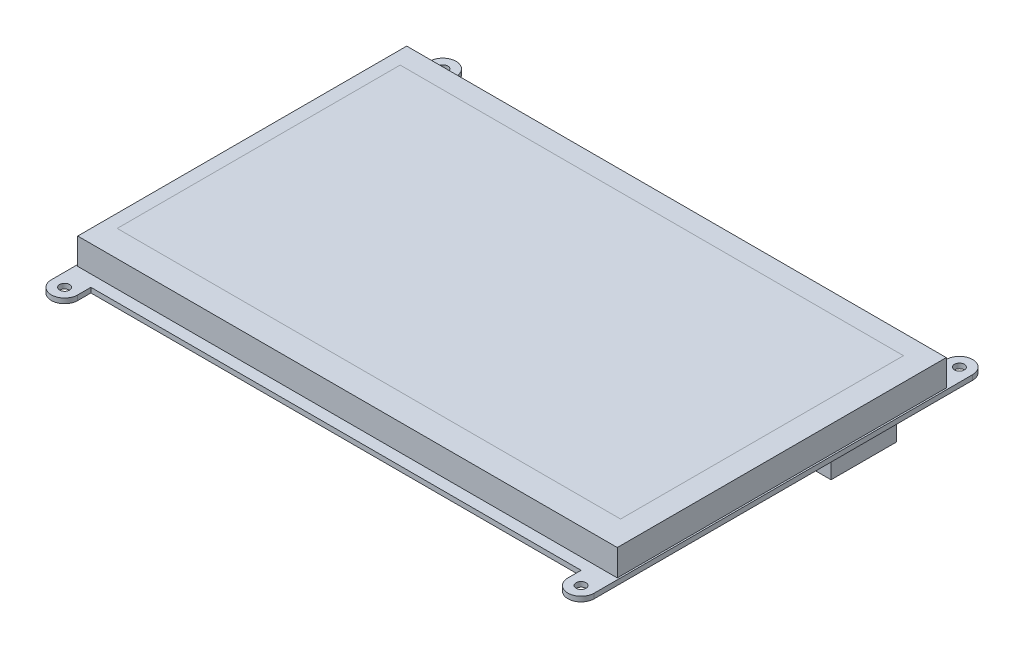
from build123d import *

# Parameters (mm, degrees)
SKETCH1_R           = 1.5
BOSS_EXTRUDE1_DEPTH = 1.5
SKETCH2_W           = 8.49594542
SKETCH2_H           = 19.836738538
SKETCH2_W_2         = 18.514132699
SKETCH2_H_2         = 9.878260544
BOSS_EXTRUDE2_DEPTH = 8
SKETCH3_W           = 164
SKETCH3_H           = 100
BOSS_EXTRUDE3_DEPTH = 8


with BuildPart() as part:
    # Sketch1 → Boss-Extrude1 (new body)
    with BuildSketch(Plane(origin=(0, 0, 0), x_dir=(1, 0, 0), z_dir=(0, 1, 0))):
        with BuildLine():
            Line((-74.5, -53.5), (74.5, -53.5))
            Line((74.5, -53.5), (74.5, -57.5))
            ThreePointArc((74.5, -57.5), (78.5, -61.5), (82.5, -57.5))
            Line((82.5, -57.5), (82.5, -23.877612559))
            Line((82.5, -23.877612559), (82.5, 23.877612559))
            Line((82.5, 23.877612559), (82.5, 57.5))
            ThreePointArc((82.5, 57.5), (78.5, 61.5), (74.5, 57.5))
            Line((74.5, 57.5), (74.5, 53.5))
            Line((74.5, 53.5), (-74.5, 53.5))
            Line((-74.5, 53.5), (-74.5, 57.5))
            ThreePointArc((-74.5, 57.5), (-78.5, 61.5), (-82.5, 57.5))
            Line((-82.5, 57.5), (-82.5, 23.877612559))
            Line((-82.5, 23.877612559), (-82.5, -23.877612559))
            Line((-82.5, -23.877612559), (-82.5, -57.5))
            ThreePointArc((-82.5, -57.5), (-78.5, -61.5), (-74.5, -57.5))
            Line((-74.5, -57.5), (-74.5, -53.5))
        make_face()
        with Locations(Location((78.5, 57.5, 0), (0, 0, 270))):
            Circle(SKETCH1_R, mode=Mode.SUBTRACT)
        with Locations(Location((-78.5, 57.5, 0), (0, 0, 90))):
            Circle(SKETCH1_R, mode=Mode.SUBTRACT)
        with Locations(Location((78.5, -57.5, 0), (0, 0, 90))):
            Circle(SKETCH1_R, mode=Mode.SUBTRACT)
        with Locations(Location((-78.5, -57.5, 0), (0, 0, 270))):
            Circle(SKETCH1_R, mode=Mode.SUBTRACT)
    extrude(amount=BOSS_EXTRUDE1_DEPTH)

    # Sketch2 → Boss-Extrude2 (add)
    with BuildSketch(Plane.XZ):
        with Locations((74.922222093, -27.720858346)):
            Rectangle(SKETCH2_W, SKETCH2_H)
        with Locations((-9.25706635, -10.936720321)):
            Rectangle(SKETCH2_W_2, SKETCH2_H_2)
    extrude(amount=BOSS_EXTRUDE2_DEPTH)

    # Sketch3 → Boss-Extrude3 (add)
    with BuildSketch(Plane(origin=(0, 1.5, 0), x_dir=(1, 0, 0), z_dir=(0, 1, 0))):
        Rectangle(SKETCH3_W, SKETCH3_H)
    extrude(amount=BOSS_EXTRUDE3_DEPTH)


solid = part.part
